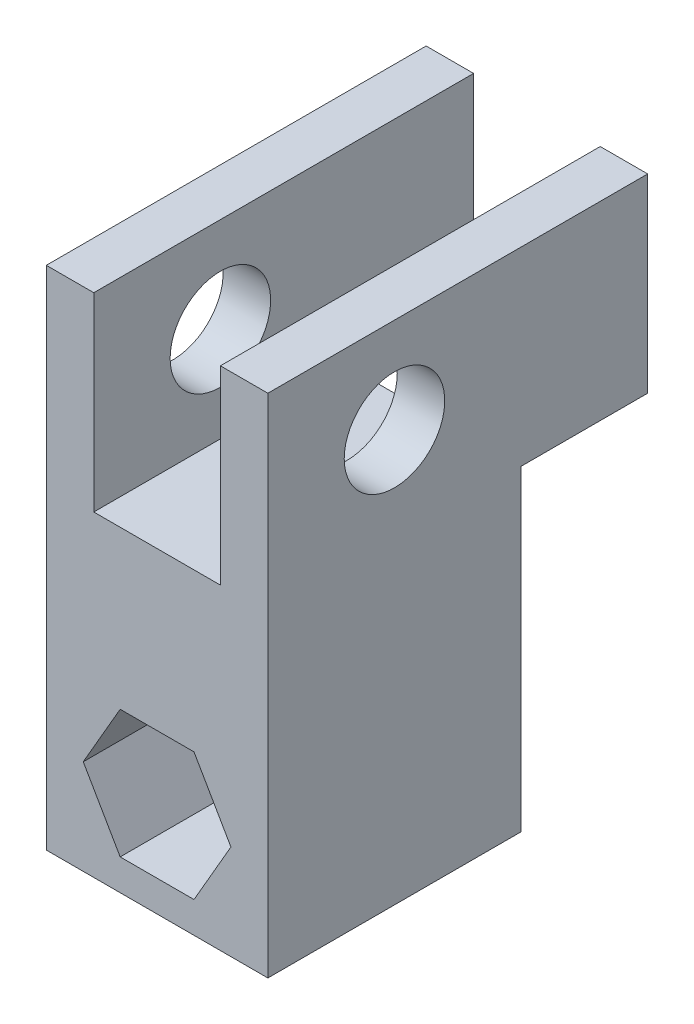
from build123d import *

# Parameters (mm, degrees)
BOSS_EXTRUDE1_DEPTH     = 25.4
CUT_EXTRUDE1_DEPTH      = 58.873030474
F_3_8_CLEARANCE_HOLE1_D = 10.0838
SKETCH7_W               = 4.7625
SKETCH7_H               = 19.05
BOSS_EXTRUDE2_DEPTH     = 12.7


with BuildPart() as part:
    # Sketch1 → Boss-Extrude1 (new body)
    with BuildSketch(Plane.XY):
        Polygon((-11.1125, 0), (11.1125, 0), (11.1125, 50.8), (6.35, 50.8), (6.35, 31.75), (-6.35, 31.75), (-6.35, 50.8), (-11.1125, 50.8), align=None)
    extrude(amount=BOSS_EXTRUDE1_DEPTH)

    # Sketch2 → Cut-Extrude1 (cut, through all)
    with BuildSketch(Plane.XY.offset(25.4)):
        Polygon((3.702835951, 15.9385), (-3.702835951, 15.9385), (-7.405671903, 9.525), (-3.702835951, 3.1115), (3.702835951, 3.1115), (7.405671903, 9.525), align=None)
    extrude(amount=-CUT_EXTRUDE1_DEPTH, mode=Mode.SUBTRACT)

    # 3/8 Clearance Hole1 (through all)
    with Locations(Plane.ZY.offset(11.1125)):
        with Locations((12.7, 41.275)):
            Hole(F_3_8_CLEARANCE_HOLE1_D / 2)

    # Sketch7 → Boss-Extrude2 (add)
    with BuildSketch(Plane(origin=(0, 0, 0), x_dir=(-1, 0, 0), z_dir=(0, 0, -1))):
        with Locations((-8.73125, 41.275)):
            Rectangle(SKETCH7_W, SKETCH7_H)
        with Locations((8.73125, 41.275)):
            Rectangle(SKETCH7_W, SKETCH7_H)
    extrude(amount=BOSS_EXTRUDE2_DEPTH)


solid = part.part
